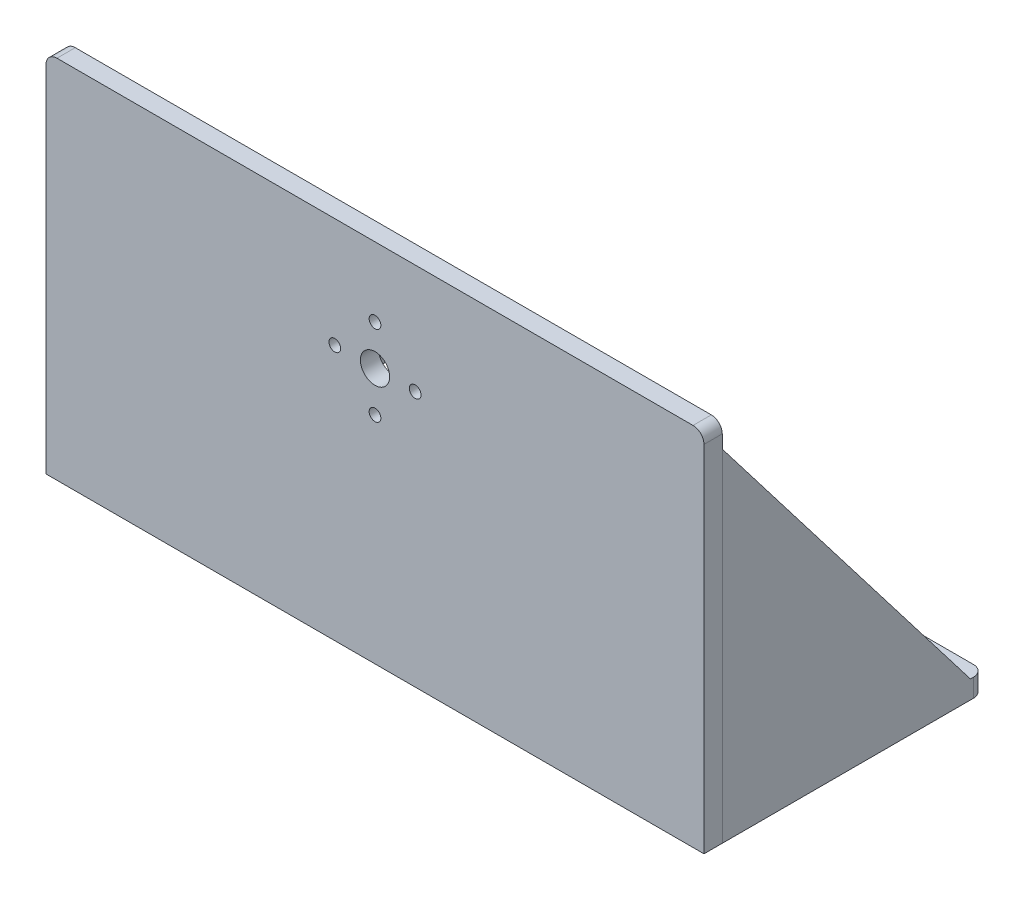
from build123d import *

# Parameters (mm, degrees)
CROQUIS1_W              = 180
CROQUIS1_H              = 100
CROQUIS1_R              = 4
CROQUIS1_R_2            = 1.6
SALIENTE_EXTRUIR1_DEPTH = 5
SALIENTE_EXTRUIR2_DEPTH = 5
CROQUIS3_W              = 20
CROQUIS3_H              = 65.440512609
CROQUIS3_R              = 2.5
SALIENTE_EXTRUIR3_DEPTH = 5
REDONDEO1_R             = 3
REDONDEO2_R             = 3


with BuildPart() as part:
    # Croquis1 → Saliente-Extruir1 (new body)
    with BuildSketch(Plane.XY):
        with Locations((0, -20)):
            Rectangle(CROQUIS1_W, CROQUIS1_H)
        Circle(CROQUIS1_R, mode=Mode.SUBTRACT)
        with Locations((0, 11)):
            Circle(CROQUIS1_R_2, mode=Mode.SUBTRACT)
        with Locations((11, 0)):
            Circle(CROQUIS1_R_2, mode=Mode.SUBTRACT)
        with Locations((0, -11)):
            Circle(CROQUIS1_R_2, mode=Mode.SUBTRACT)
        with Locations((-11, 0)):
            Circle(CROQUIS1_R_2, mode=Mode.SUBTRACT)
    extrude(amount=SALIENTE_EXTRUIR1_DEPTH)

    # Redondeo2
    redondeo2_edges = [part.edges().sort_by_distance(p)[0] for p in [
        (-90, 30, 2.5),
        (90, 30, 2.5),
    ]]
    fillet(redondeo2_edges, radius=REDONDEO2_R)


with BuildPart() as body_2:
    # Croquis2 → Saliente-Extruir2 (new body)
    with BuildSketch(Plane(origin=(90, 0, 0), x_dir=(0, 0, -1), z_dir=(1, 0, 0))):
        Polygon((0, -70), (0, 23.383318785), (71.725434948, -70), align=None)
    extrude(amount=-SALIENTE_EXTRUIR2_DEPTH)

    # Croquis3 → Saliente-Extruir3 (add)
    with BuildSketch(Plane.XZ.offset(70)):
        with Locations((80, -39.005178644)):
            Rectangle(CROQUIS3_W, CROQUIS3_H)
        with Locations((77.672983275, -22.40042671)):
            Circle(CROQUIS3_R, mode=Mode.SUBTRACT)
        with Locations((77.672983275, -49.759306223)):
            Circle(CROQUIS3_R, mode=Mode.SUBTRACT)
    extrude(amount=-SALIENTE_EXTRUIR3_DEPTH)

    # Redondeo1
    redondeo1_edges = [body_2.edges().sort_by_distance(p)[0] for p in [
        (90, -67.5, -71.725434948),
        (70, -67.5, -71.725434948),
        (70, -67.5, -6.284922339),
    ]]
    fillet(redondeo1_edges, radius=REDONDEO1_R)


with BuildPart() as body_3:
    # Simetría4: mirrored copy
    add(body_2.part.mirror(Plane(origin=(0, 0, 0), x_dir=(0, 0, 1), z_dir=(1, 0, 0))))


solid = Compound([part.part, body_2.part, body_3.part])
